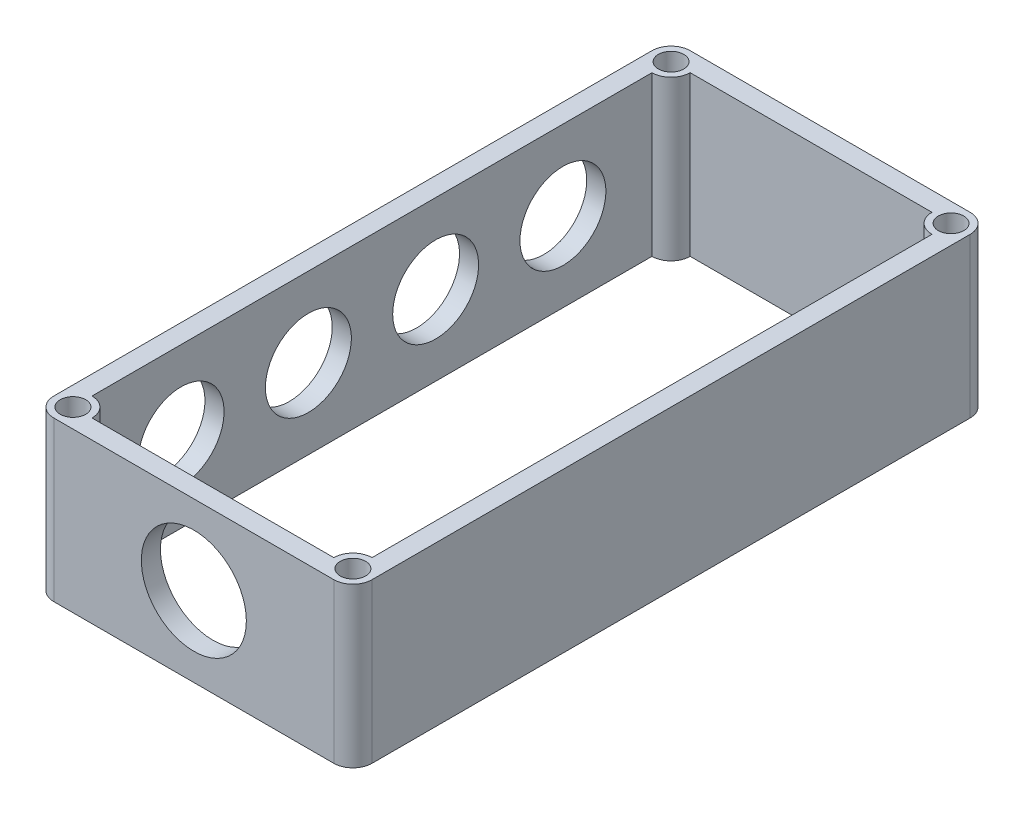
from build123d import *

# Parameters (mm, degrees)
SKETCH1_R           = 2
BOSS_EXTRUDE1_DEPTH = 25
CUT_EXTRUDE1_REACH  = 108.066
SKETCH2_R           = 8.25
CUT_EXTRUDE2_REACH  = 77
SKETCH3_R           = 6.75


with BuildPart() as part:
    # Sketch1 → Boss-Extrude1 (new body)
    with BuildSketch(Plane(origin=(0, 0, 0), x_dir=(1, 0, 0), z_dir=(0, 1, 0))):
        with BuildLine():
            ThreePointArc((-22, 50), (-24.121320344, 49.121320344), (-25, 47))
            Line((-25, 47), (-25, -47))
            ThreePointArc((-25, -47), (-24.121320344, -49.121320344), (-22, -50))
            Line((-22, -50), (22, -50))
            ThreePointArc((22, -50), (24.121320344, -49.121320344), (25, -47))
            Line((25, -47), (25, 47))
            ThreePointArc((25, 47), (24.121320344, 49.121320344), (22, 50))
            Line((22, 50), (-22, 50))
        make_face()
        with Locations(Location((-22, -47, 0), (0, 0, 270))):
            Circle(SKETCH1_R, mode=Mode.SUBTRACT)
        with BuildLine():
            Line((-22, -44), (-22, 44))
            ThreePointArc((-22, 44), (-19.878679656, 44.878679656), (-19, 47))
            Line((-19, 47), (19, 47))
            ThreePointArc((19, 47), (19.878679656, 44.878679656), (22, 44))
            Line((22, 44), (22, -44))
            ThreePointArc((22, -44), (19.878679656, -44.878679656), (19, -47))
            Line((19, -47), (-19, -47))
            ThreePointArc((-19, -47), (-19.878679656, -44.878679656), (-22, -44))
        make_face(mode=Mode.SUBTRACT)
        with Locations(Location((22, 47, 0), (0, 0, 270))):
            Circle(SKETCH1_R, mode=Mode.SUBTRACT)
        with Locations(Location((-22, 47, 0), (0, 0, 270))):
            Circle(SKETCH1_R, mode=Mode.SUBTRACT)
        with Locations(Location((22, -47, 0), (0, 0, 270))):
            Circle(SKETCH1_R, mode=Mode.SUBTRACT)
    extrude(amount=BOSS_EXTRUDE1_DEPTH)

    # Sketch2 → Cut-Extrude1 (cut, up to next)
    with BuildSketch(Plane.XY.offset(50), mode=Mode.PRIVATE) as cut_extrude1_sk1:
        with Locations((0, 12.5)):
            Circle(SKETCH2_R)
    cut_extrude1_tool1 = extrude(cut_extrude1_sk1.sketch, amount=-CUT_EXTRUDE1_REACH, mode=Mode.PRIVATE) & part.part
    add(cut_extrude1_tool1.solids().sort_by_distance((0, 12.5, 50))[0], mode=Mode.SUBTRACT)

    # Sketch3 → Cut-Extrude2 (cut, up to next)
    with BuildSketch(Plane.ZY.offset(25), mode=Mode.PRIVATE) as cut_extrude2_sk1:
        with Locations((-30, 12.5)):
            Circle(SKETCH3_R)
    cut_extrude2_tool1 = extrude(cut_extrude2_sk1.sketch, amount=-CUT_EXTRUDE2_REACH, mode=Mode.PRIVATE) & part.part
    # Sketch3 → Cut-Extrude2 (cut, up to next)
    with BuildSketch(Plane.ZY.offset(25), mode=Mode.PRIVATE) as cut_extrude2_sk2:
        with Locations((-10, 12.5)):
            Circle(SKETCH3_R)
    cut_extrude2_tool2 = extrude(cut_extrude2_sk2.sketch, amount=-CUT_EXTRUDE2_REACH, mode=Mode.PRIVATE) & part.part
    # Sketch3 → Cut-Extrude2 (cut, up to next)
    with BuildSketch(Plane.ZY.offset(25), mode=Mode.PRIVATE) as cut_extrude2_sk3:
        with Locations((10, 12.5)):
            Circle(SKETCH3_R)
    cut_extrude2_tool3 = extrude(cut_extrude2_sk3.sketch, amount=-CUT_EXTRUDE2_REACH, mode=Mode.PRIVATE) & part.part
    # Sketch3 → Cut-Extrude2 (cut, up to next)
    with BuildSketch(Plane.ZY.offset(25), mode=Mode.PRIVATE) as cut_extrude2_sk4:
        with Locations((30, 12.5)):
            Circle(SKETCH3_R)
    cut_extrude2_tool4 = extrude(cut_extrude2_sk4.sketch, amount=-CUT_EXTRUDE2_REACH, mode=Mode.PRIVATE) & part.part
    add(cut_extrude2_tool1.solids().sort_by_distance((-25, 12.5, -30))[0], mode=Mode.SUBTRACT)
    add(cut_extrude2_tool2.solids().sort_by_distance((-25, 12.5, -10))[0], mode=Mode.SUBTRACT)
    add(cut_extrude2_tool3.solids().sort_by_distance((-25, 12.5, 10))[0], mode=Mode.SUBTRACT)
    add(cut_extrude2_tool4.solids().sort_by_distance((-25, 12.5, 30))[0], mode=Mode.SUBTRACT)


solid = part.part
